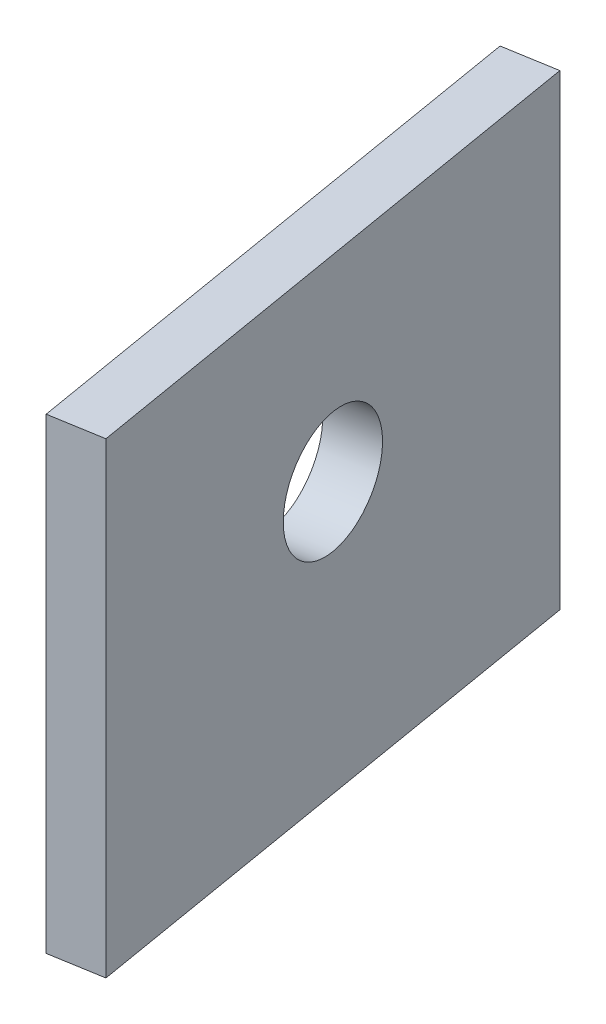
from build123d import *

# Parameters (mm, degrees)
CROQUIS1_W              = 16
CROQUIS1_H              = 13.5
CROQUIS1_R              = 1.75
SALIENTE_EXTRUIR1_DEPTH = 1.5


with BuildPart() as part:
    # Croquis1 → Saliente-Extruir1 (new body)
    with BuildSketch(Plane(origin=(30.78196743, 0, -5.182245024), x_dir=(-0.16601701758574913, 0, -0.9861228878146644), z_dir=(0.9861228878146644, 0, -0.16601701758574913))):
        with Locations((-182.248532362, 15.95)):
            Rectangle(CROQUIS1_W, CROQUIS1_H)
        with Locations(Location((-182.248532362, 17.017761633, 0), (0, 0, 180))):
            Circle(CROQUIS1_R, mode=Mode.SUBTRACT)
    extrude(amount=SALIENTE_EXTRUIR1_DEPTH)


solid = part.part
